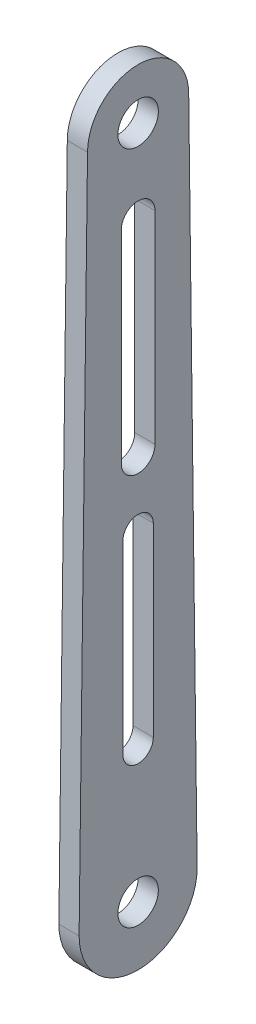
from build123d import *

# Parameters (mm, degrees)
SKETCH_1_R          = 6
EXTRUDE_1_DEPTH     = 6
CUT_EXTRUDE_1_DEPTH = 10


with BuildPart() as part:
    # 草图1 → 凸台-拉伸1 (new body)
    with BuildSketch(Plane(origin=(0, 0, 0), x_dir=(0, 0, -1), z_dir=(1, 0, 0))):
        with BuildLine():
            Line((15, 0), (17.5, -200))
            ThreePointArc((17.5, -200), (0, -217.5), (-17.5, -200))
            Line((-17.5, -200), (-15, 0))
            ThreePointArc((-15, 0), (0, 15), (15, 0))
        make_face()
        Circle(SKETCH_1_R, mode=Mode.SUBTRACT)
        with Locations((0, -200)):
            Circle(SKETCH_1_R, mode=Mode.SUBTRACT)
    extrude(amount=EXTRUDE_1_DEPTH)

    # 草图2 → 切除-拉伸1 (cut)
    with BuildSketch(Plane(origin=(6, 0, 0), x_dir=(0, 0, -1), z_dir=(1, 0, 0))):
        with BuildLine():
            Line((5, -25), (5, -85))
            ThreePointArc((5, -85), (0, -90), (-5, -85))
            Line((-5, -85), (-5, -25))
            ThreePointArc((-5, -25), (0, -20), (5, -25))
        make_face()
        with BuildLine():
            Line((4.5, -105), (4.5, -160))
            ThreePointArc((4.5, -160), (0, -164.5), (-4.5, -160))
            Line((-4.5, -160), (-4.5, -105))
            ThreePointArc((-4.5, -105), (0, -100.5), (4.5, -105))
        make_face()
    extrude(amount=-CUT_EXTRUDE_1_DEPTH, mode=Mode.SUBTRACT)


solid = part.part
